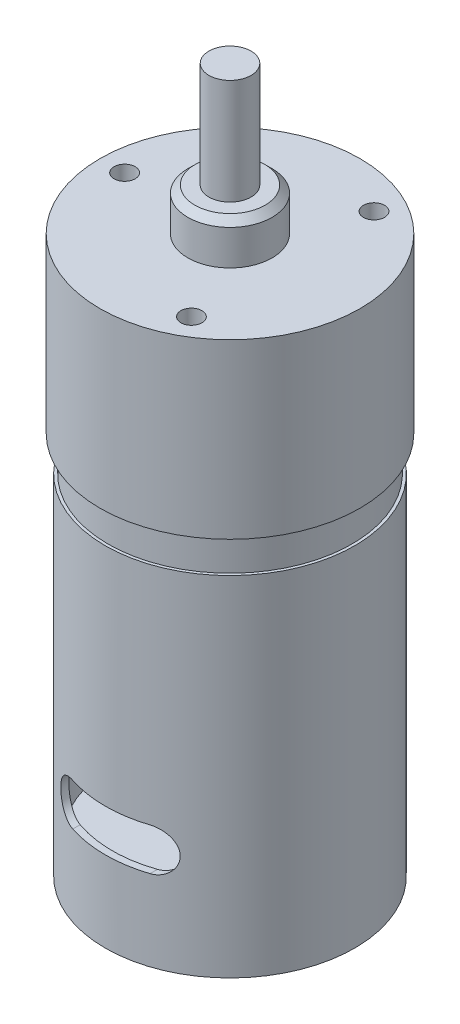
from build123d import *

# Parameters (mm, degrees)
EXTRUSION1_REACH                  = 105.556
EXTRUSION1_END_RADIUS             = 17.75
EXTRUSION1_DIRECTION_2_REACH      = 105.556
EXTRUSION1_DIRECTION_2_END_RADIUS = 17.75
CHANFREIN1_SIZE                   = 1
ESQUISSE3_R                       = 16.75
EXTRUSION2_DEPTH                  = 49
EXTRUSION3_START                  = -5
ESQUISSE6_R                       = 17.75
EXTRUSION3_DEPTH                  = 5
ESQUISSE8_R                       = 1.5
EXTRUSION4_DEPTH                  = 5


with BuildPart() as part:
    # Esquisse1 → Révolution1 (revolve)
    with BuildSketch(Plane.XY, mode=Mode.PRIVATE) as r_volution1_sk:
        Polygon((0, 0), (17.75, 0), (17.75, 49.6), (17.35, 49.6), (17.35, 54.6), (18.5, 54.596448784), (18.5, 79.196448784), (6, 79.196448784), (6, 85.196448784), (3, 85.196448784), (3, 100.196448784), (0, 100.196448784), align=None)
    revolve(r_volution1_sk.sketch.rotate(Axis((0, 100.196448784, 0), (0, -1, 0)), 90), axis=Axis((0, 100.196448784, 0), (0, -1, 0)))

    # Extrusion1: up to this cylinder (the profile starts inside it)
    extrusion1_end = Plane(origin=(0, 14.5, 0), z_dir=(0, 1, 0)) * Cylinder(EXTRUSION1_END_RADIUS, 247.612, mode=Mode.PRIVATE)
    # Esquisse2 → Extrusion1 (cut, up to the surface)
    with BuildSketch(Plane.XY, mode=Mode.PRIVATE) as extrusion1_sk1:
        with BuildLine():
            Line((-5.5, 17.5), (5.5, 17.5))
            ThreePointArc((5.5, 17.5), (8.5, 14.5), (5.5, 11.5))
            Line((5.5, 11.5), (-5.5, 11.5))
            ThreePointArc((-5.5, 11.5), (-8.5, 14.5), (-5.5, 17.5))
        make_face()
    extrusion1_tool1 = extrude(extrusion1_sk1.sketch, amount=EXTRUSION1_REACH, mode=Mode.PRIVATE) & extrusion1_end
    add(extrusion1_tool1.solids().sort_by_distance((0, 14.5, 0))[0], mode=Mode.SUBTRACT)

    # Extrusion1 direction 2: up to this cylinder (the profile starts inside it)
    extrusion1_direction_2_end = Plane(origin=(0, 14.5, 0), z_dir=(0, 1, 0)) * Cylinder(EXTRUSION1_DIRECTION_2_END_RADIUS, 247.612, mode=Mode.PRIVATE)
    # Esquisse2 → Extrusion1 direction 2 (cut, up to the surface)
    with BuildSketch(Plane.XY, mode=Mode.PRIVATE) as extrusion1_direction_2_sk1:
        with BuildLine():
            Line((-5.5, 17.5), (5.5, 17.5))
            ThreePointArc((5.5, 17.5), (8.5, 14.5), (5.5, 11.5))
            Line((5.5, 11.5), (-5.5, 11.5))
            ThreePointArc((-5.5, 11.5), (-8.5, 14.5), (-5.5, 17.5))
        make_face()
    extrusion1_direction_2_tool1 = extrude(extrusion1_direction_2_sk1.sketch, amount=-EXTRUSION1_DIRECTION_2_REACH, mode=Mode.PRIVATE) & extrusion1_direction_2_end
    add(extrusion1_direction_2_tool1.solids().sort_by_distance((0, 14.5, 0))[0], mode=Mode.SUBTRACT)

    # Chanfrein1
    chanfrein1_edges = [part.edges().sort_by_distance(p)[0] for p in [
        (0, 85.196448784, -6),
    ]]
    chamfer(chanfrein1_edges, length=CHANFREIN1_SIZE)

    # Esquisse3 → Extrusion2 (cut)
    with BuildSketch(Plane.XZ):
        with Locations(Location((0, 0, 0), (0, 0, 270))):
            Circle(ESQUISSE3_R)
    extrude(amount=-EXTRUSION2_DEPTH, mode=Mode.SUBTRACT)

    # Esquisse6 → Extrusion3 (add)
    with BuildSketch(Plane.XZ.offset(EXTRUSION3_START)):
        with Locations(Location((0, 0, 0), (0, 0, 90))):
            Circle(ESQUISSE6_R)
    extrude(amount=EXTRUSION3_DEPTH)

    # Esquisse8 → Extrusion4 (cut)
    with BuildSketch(Plane(origin=(0, 79.196448784, 0), x_dir=(-1, 0, 0), z_dir=(0, 1, 0))):
        with Locations(Location((15, 0, 0), (0, 0, 90))):
            Circle(ESQUISSE8_R)
        with Locations(Location((-7.5, -12.990381057, 0), (0, 0, 90))):
            Circle(ESQUISSE8_R)
        with Locations(Location((-7.5, 12.990381057, 0), (0, 0, 90))):
            Circle(ESQUISSE8_R)
    extrude(amount=-EXTRUSION4_DEPTH, mode=Mode.SUBTRACT)


solid = part.part
